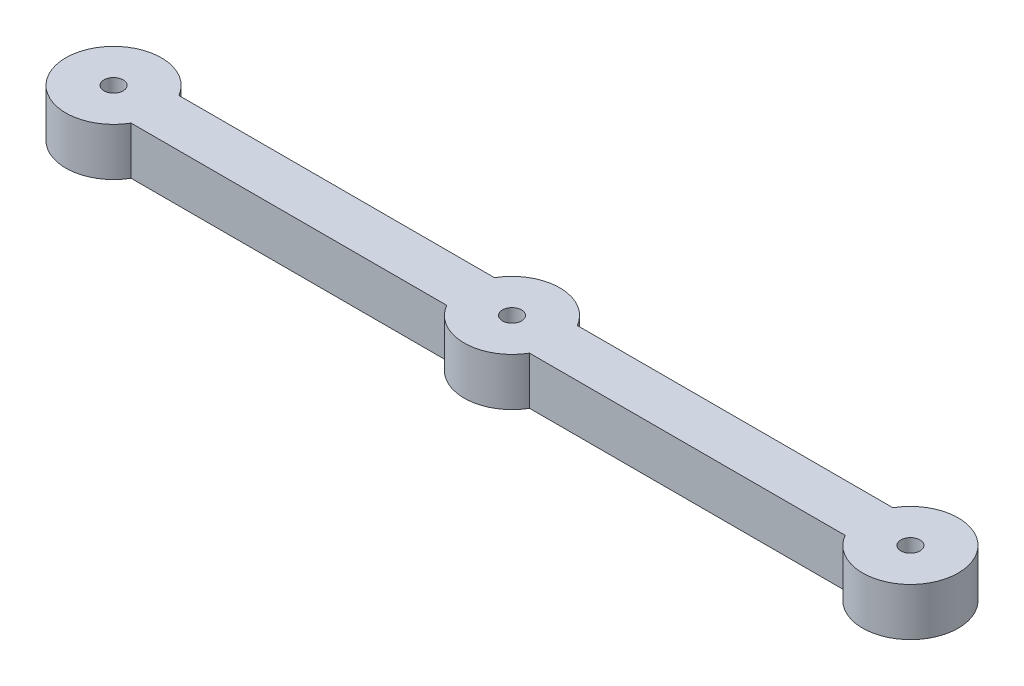
from build123d import *

# Parameters (mm, degrees)
SKETCH_4_R          = 3
SKETCH_4_W          = 50
SKETCH_4_H          = 3
EXTRUDE_1_DEPTH     = 3
SKETCH_5_R          = 1.5
CUT_EXTRUDE_1_DEPTH = 1.2
SKETCH_6_R          = 0.6
CUT_EXTRUDE_2_DEPTH = 29.319604517


with BuildPart() as part:
    # 草图4 → 凸台-拉伸1 (new body)
    with BuildSketch(Plane(origin=(0, 0, 0), x_dir=(1, 0, 0), z_dir=(0, 1, 0))):
        Circle(SKETCH_4_R)
        with Locations((25, 0)):
            Circle(SKETCH_4_R)
        with Locations((-25, 0)):
            Circle(SKETCH_4_R)
        Rectangle(SKETCH_4_W, SKETCH_4_H)
    extrude(amount=EXTRUDE_1_DEPTH)

    # 草图5 → 切除-拉伸1 (cut)
    with BuildSketch(Plane.XZ):
        with Locations(Location((-25, 0, 0), (0, 0, 270))):
            Circle(SKETCH_5_R)
        with Locations(Location((0, 0, 0), (0, 0, 270))):
            Circle(SKETCH_5_R)
        with Locations(Location((25, 0, 0), (0, 0, 270))):
            Circle(SKETCH_5_R)
    extrude(amount=-CUT_EXTRUDE_1_DEPTH, mode=Mode.SUBTRACT)

    # 草图6 → 切除-拉伸2 (cut, through all)
    with BuildSketch(Plane(origin=(0, 0, 0), x_dir=(-1, 0, 0), z_dir=(0, -1, 0))):
        with Locations(Location((0, 0, 0), (0, 0, 90))):
            Circle(SKETCH_6_R)
        with Locations(Location((-25, 0, 0), (0, 0, 90))):
            Circle(SKETCH_6_R)
        with Locations(Location((25, 0, 0), (0, 0, 90))):
            Circle(SKETCH_6_R)
    extrude(amount=-CUT_EXTRUDE_2_DEPTH, mode=Mode.SUBTRACT)


solid = part.part
